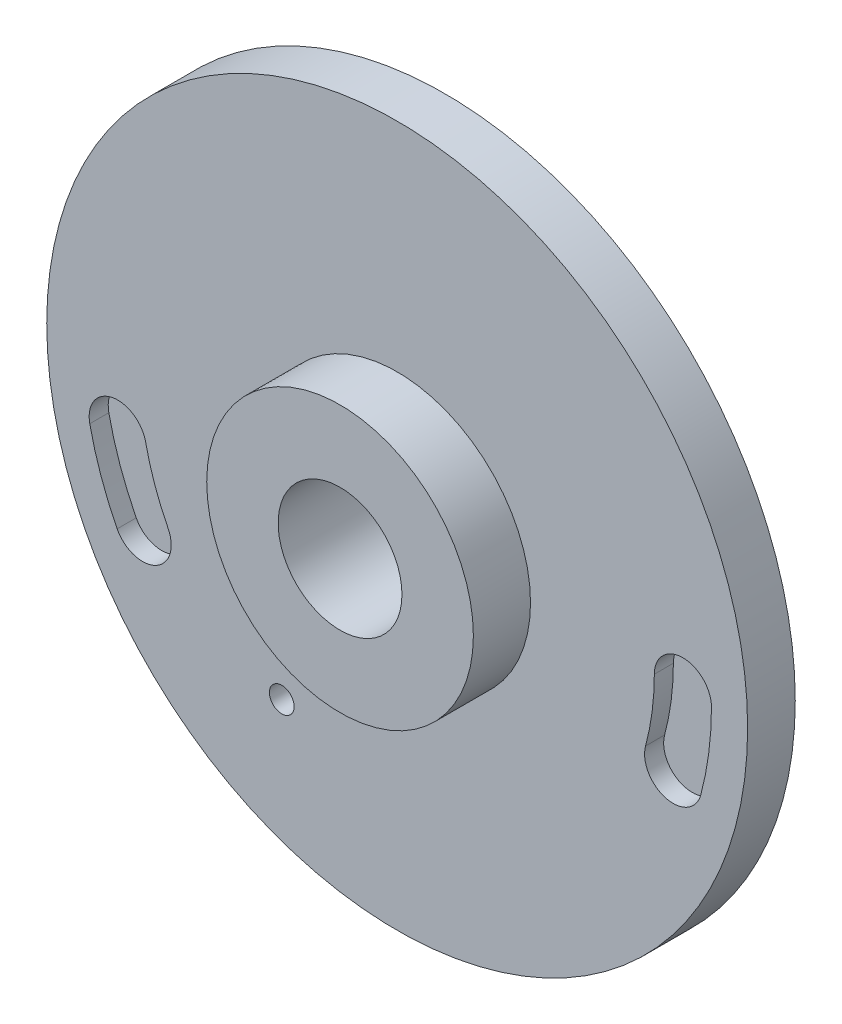
from build123d import *

# Parameters (mm, degrees)
SKETCH1_R                   = 36.8
BOSS_EXTRUDE1_DEPTH         = 5
SKETCH7_R                   = 14
BOSS_EXTRUDE2_DEPTH         = 6
SKETCH2_R                   = 6.5
CUT_EXTRUDE1_DEPTH          = 54.192856663
CUT_EXTRUDE2_DEPTH          = 2
CUT_EXTRUDE3_DEPTH          = 2
TAP_DRILL_FOR_M3X0_5_TAP1_D = 2.6


with BuildPart() as part:
    # Sketch1 → Boss-Extrude1 (new body)
    with BuildSketch(Plane.XY):
        Circle(SKETCH1_R)
    extrude(amount=BOSS_EXTRUDE1_DEPTH)

    # Sketch7 → Boss-Extrude2 (add)
    with BuildSketch(Plane.XY.offset(5)):
        Circle(SKETCH7_R)
    extrude(amount=BOSS_EXTRUDE2_DEPTH)

    # Sketch2 → Cut-Extrude1 (cut, through all)
    with BuildSketch(Plane.XY.offset(11)):
        Circle(SKETCH2_R)
    extrude(amount=-CUT_EXTRUDE1_DEPTH, mode=Mode.SUBTRACT)

    # Sketch3 → Cut-Extrude2 (cut)
    with BuildSketch(Plane.XY.offset(5)):
        with BuildLine():
            ThreePointArc((-26.40998522, -5.613615652), (-25.451320259, -9.012785199), (-24.057176153, -12.257743493))
            ThreePointArc((-24.057176153, -12.257743493), (-25.368224226, -16.292734565), (-29.403215298, -14.981686491))
            ThreePointArc((-29.403215298, -14.981686491), (-31.107169206, -11.015626355), (-32.278870824, -6.861085797))
            ThreePointArc((-32.278870824, -6.861085797), (-29.968163094, -3.302907922), (-26.40998522, -5.613615652))
        make_face()
    extrude(amount=-CUT_EXTRUDE2_DEPTH, mode=Mode.SUBTRACT)

    # Sketch4 → Cut-Extrude3 (cut)
    with BuildSketch(Plane.XY.offset(5)):
        with BuildLine():
            ThreePointArc((26.07999731, -6.988114218), (26.769011257, -3.52420719), (27, 0))
            ThreePointArc((27, 0), (30, 3), (33, 0))
            ThreePointArc((33, 0), (32.717680425, -4.307364343), (31.875552268, -8.541028488))
            ThreePointArc((31.875552268, -8.541028488), (28.201317653, -10.662348832), (26.07999731, -6.988114218))
        make_face()
    extrude(amount=-CUT_EXTRUDE3_DEPTH, mode=Mode.SUBTRACT)

    # Tap Drill for M3x0.5 Tap1 (through all)
    with Locations(Plane.XY.offset(5)):
        with Locations((-12.120240506, -21.865492678)):
            Hole(TAP_DRILL_FOR_M3X0_5_TAP1_D / 2)


solid = part.part
